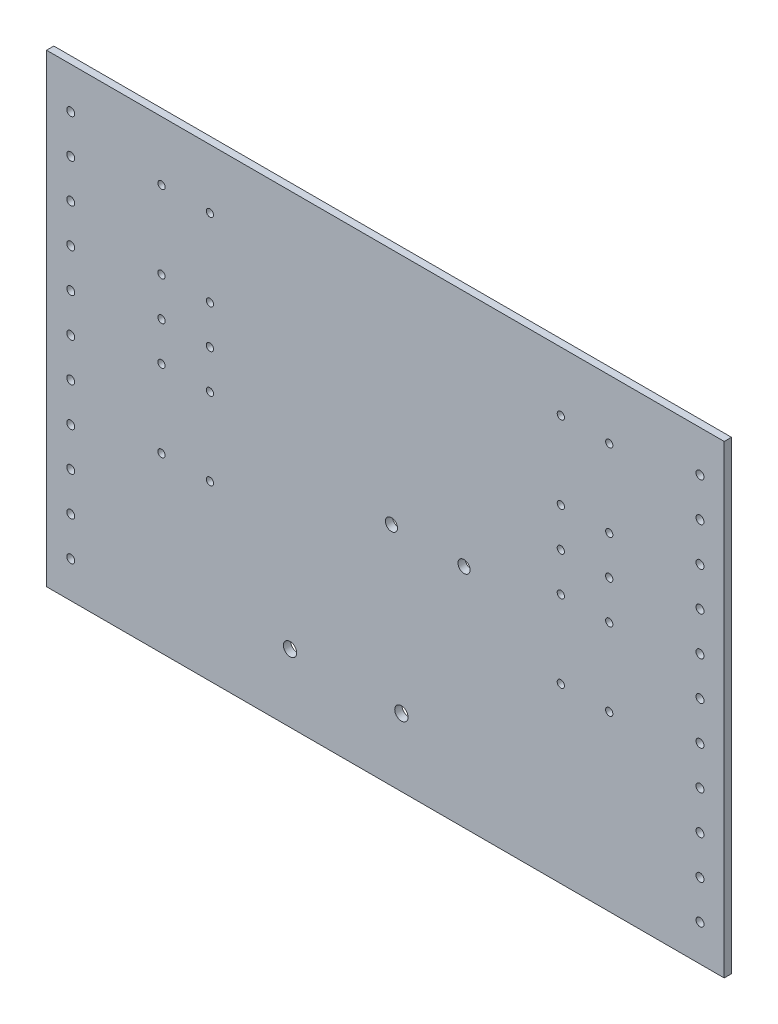
from build123d import *

# Parameters (mm, degrees)
SKETCH_1_W          = 280
SKETCH_1_H          = 200
EXTRUDE_1_DEPTH     = 3
SKETCH_2_R          = 1.5
SKETCH_2_R_2        = 2.75
SKETCH_2_R_3        = 2.5
CUT_EXTRUDE_1_DEPTH = 3
SKETCH_3_W          = 280
SKETCH_3_H          = 8
CUT_EXTRUDE_2_DEPTH = 173.072659072
SKETCH_4_R          = 1.65
CUT_EXTRUDE_4_DEPTH = 173.072659072


with BuildPart() as part:
    # 草图1 → 凸台-拉伸1 (new body)
    with BuildSketch(Plane.XY):
        Rectangle(SKETCH_1_W, SKETCH_1_H)
    extrude(amount=EXTRUDE_1_DEPTH)

    # 草图2 → 切除-拉伸1 (cut)
    with BuildSketch(Plane(origin=(0, 0, 0), x_dir=(-1, 0, 0), z_dir=(0, 0, -1))):
        with Locations((92.5, 19.5)):
            Circle(SKETCH_2_R)
        with Locations((92.5, 35.5)):
            Circle(SKETCH_2_R)
        with Locations((92.5, 3.5)):
            Circle(SKETCH_2_R)
        with Locations((92.5, -28.5)):
            Circle(SKETCH_2_R)
        with Locations((92.5, 67.5)):
            Circle(SKETCH_2_R)
        with Locations((72.5, 67.5)):
            Circle(SKETCH_2_R)
        with Locations((72.5, 35.5)):
            Circle(SKETCH_2_R)
        with Locations((72.5, 19.5)):
            Circle(SKETCH_2_R)
        with Locations((72.5, 3.5)):
            Circle(SKETCH_2_R)
        with Locations((72.5, -28.5)):
            Circle(SKETCH_2_R)
        with Locations((-92.5, -28.5)):
            Circle(SKETCH_2_R)
        with Locations((-92.5, 3.5)):
            Circle(SKETCH_2_R)
        with Locations((-92.5, 19.5)):
            Circle(SKETCH_2_R)
        with Locations((-92.5, 35.5)):
            Circle(SKETCH_2_R)
        with Locations((-92.5, 67.5)):
            Circle(SKETCH_2_R)
        with Locations((-72.5, -28.5)):
            Circle(SKETCH_2_R)
        with Locations((-72.5, 3.5)):
            Circle(SKETCH_2_R)
        with Locations((-72.5, 19.5)):
            Circle(SKETCH_2_R)
        with Locations((-72.5, 35.5)):
            Circle(SKETCH_2_R)
        with Locations((-72.5, 67.5)):
            Circle(SKETCH_2_R)
        with Locations((39.38, -72)):
            Circle(SKETCH_2_R_2)
        with Locations((-6.62, -72)):
            Circle(SKETCH_2_R_2)
        with Locations((-2.5, -6.5)):
            Circle(SKETCH_2_R_3)
        with Locations((-32.5, -6.5)):
            Circle(SKETCH_2_R_3)
    extrude(amount=-CUT_EXTRUDE_1_DEPTH, mode=Mode.SUBTRACT)

    # 草图3 → 切除-拉伸2 (cut, through all)
    with BuildSketch(Plane(origin=(0, 0, 0), x_dir=(-1, 0, 0), z_dir=(0, 0, -1))):
        with Locations((0, 96)):
            Rectangle(SKETCH_3_W, SKETCH_3_H)
    extrude(amount=-CUT_EXTRUDE_2_DEPTH, mode=Mode.SUBTRACT)

    # 草图4 → 切除-拉伸4 (cut, through all)
    with BuildSketch(Plane(origin=(0, 0, 0), x_dir=(-1, 0, 0), z_dir=(0, 0, -1))):
        with Locations((-130, 75)):
            Circle(SKETCH_4_R)
        with Locations((-130, 59)):
            Circle(SKETCH_4_R)
        with Locations((-130, 43)):
            Circle(SKETCH_4_R)
        with Locations((-130, 27)):
            Circle(SKETCH_4_R)
        with Locations((-130, 11)):
            Circle(SKETCH_4_R)
        with Locations((-130, -5)):
            Circle(SKETCH_4_R)
        with Locations((-130, -21)):
            Circle(SKETCH_4_R)
        with Locations((-130, -37)):
            Circle(SKETCH_4_R)
        with Locations((-130, -53)):
            Circle(SKETCH_4_R)
        with Locations((-130, -69)):
            Circle(SKETCH_4_R)
        with Locations((-130, -85)):
            Circle(SKETCH_4_R)
        with Locations(Location((130, -85, 0), (0, 0, 180))):
            Circle(SKETCH_4_R)
        with Locations(Location((130, -69, 0), (0, 0, 180))):
            Circle(SKETCH_4_R)
        with Locations(Location((130, -53, 0), (0, 0, 180))):
            Circle(SKETCH_4_R)
        with Locations(Location((130, -37, 0), (0, 0, 180))):
            Circle(SKETCH_4_R)
        with Locations(Location((130, -21, 0), (0, 0, 180))):
            Circle(SKETCH_4_R)
        with Locations(Location((130, -5, 0), (0, 0, 180))):
            Circle(SKETCH_4_R)
        with Locations(Location((130, 11, 0), (0, 0, 180))):
            Circle(SKETCH_4_R)
        with Locations(Location((130, 27, 0), (0, 0, 180))):
            Circle(SKETCH_4_R)
        with Locations(Location((130, 43, 0), (0, 0, 180))):
            Circle(SKETCH_4_R)
        with Locations(Location((130, 59, 0), (0, 0, 180))):
            Circle(SKETCH_4_R)
        with Locations(Location((130, 75, 0), (0, 0, 180))):
            Circle(SKETCH_4_R)
    extrude(amount=-CUT_EXTRUDE_4_DEPTH, mode=Mode.SUBTRACT)


solid = part.part
